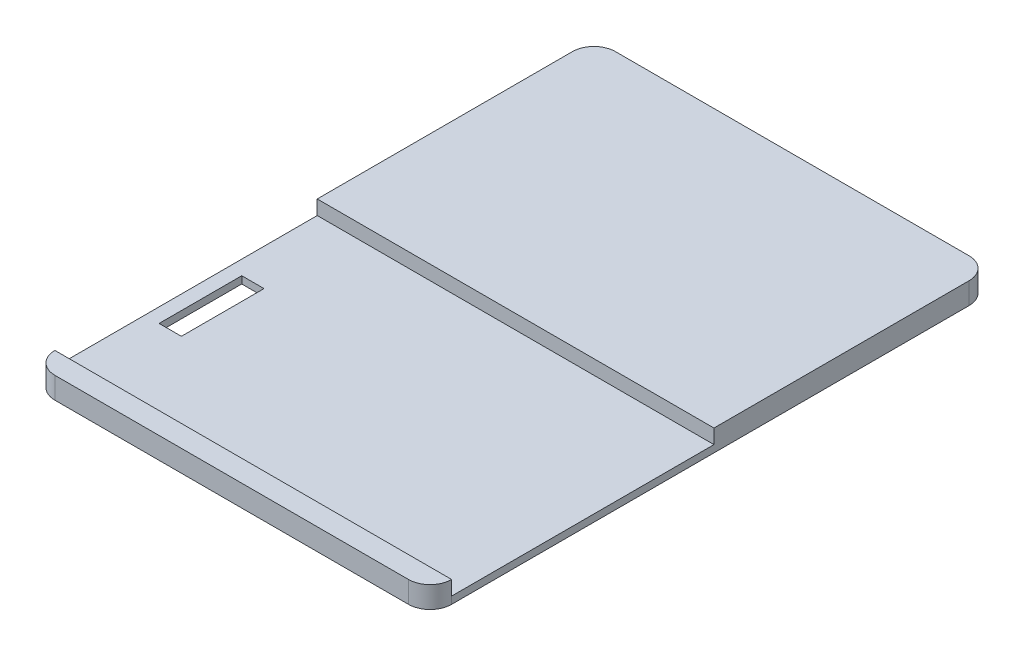
from build123d import *

# Parameters (mm, degrees)
BOSS_EXTRUDE1_DEPTH   = 3
BOSS_EXTRUDE1_2_DEPTH = 3
SKETCH1_5_W           = 55.2
SKETCH1_5_H           = 36.5
SKETCH1_5_W_2         = 3.1
SKETCH1_5_H_2         = 11.5
BOSS_EXTRUDE2_DEPTH   = 1


with BuildPart() as part:
    # Sketch1 → Boss-Extrude1 (new body)
    with BuildSketch(Plane(origin=(0, 0, 0), x_dir=(1, 0, 0), z_dir=(0, 1, 0))):
        with BuildLine():
            ThreePointArc((-27.6, -36), (-26.721320344, -38.121320344), (-24.6, -39))
            Line((-24.6, -39), (24.6, -39))
            ThreePointArc((24.6, -39), (26.721320344, -38.121320344), (27.6, -36))
            Line((27.6, -36), (-27.6, -36))
        make_face()
    extrude(amount=BOSS_EXTRUDE1_DEPTH)



with BuildPart() as body_2:
    # Sketch1 → Boss-Extrude1 2 (new body)
    with BuildSketch(Plane(origin=(0, 0, 0), x_dir=(1, 0, 0), z_dir=(0, 1, 0))):
        with BuildLine():
            Line((-27.6, 36), (-27.6, 0.5))
            Line((-27.6, 0.5), (27.6, 0.5))
            Line((27.6, 0.5), (27.6, 36))
            ThreePointArc((27.6, 36), (26.721320344, 38.121320344), (24.6, 39))
            Line((24.6, 39), (-24.6, 39))
            ThreePointArc((-24.6, 39), (-26.721320344, 38.121320344), (-27.6, 36))
        make_face()
    extrude(amount=BOSS_EXTRUDE1_2_DEPTH)


with BuildPart() as part_1:
    add(part.part)

    add(body_2.part)  # Boss-Extrude2 merges body 2
    # Sketch1<5> → Boss-Extrude2 (add)
    with BuildSketch(Plane(origin=(0, 0, 0), x_dir=(1, 0, 0), z_dir=(0, 1, 0))):
        with Locations((0, -17.75)):
            Rectangle(SKETCH1_5_W, SKETCH1_5_H)
        with Locations((-24.05, -17.75)):
            Rectangle(SKETCH1_5_W_2, SKETCH1_5_H_2, mode=Mode.SUBTRACT)
    extrude(amount=BOSS_EXTRUDE2_DEPTH)


solid = part_1.part
